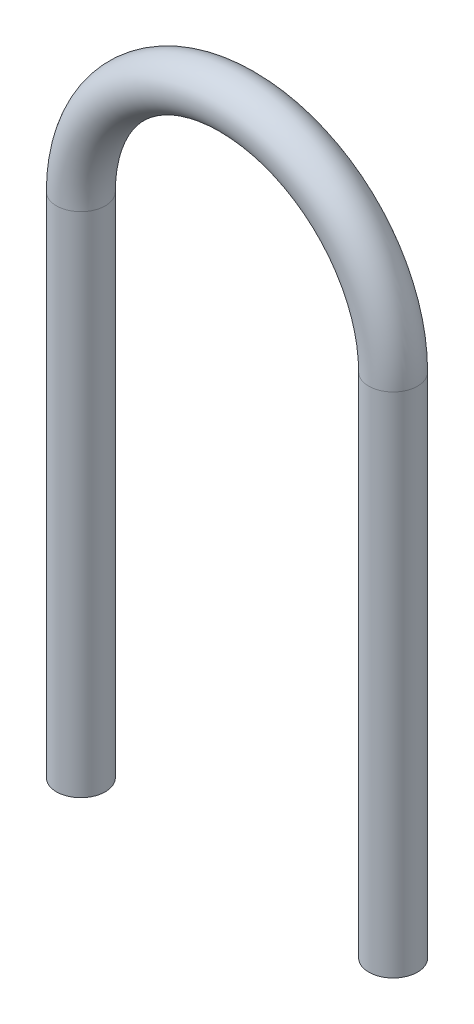
from build123d import *

# Parameters (mm, degrees)
ESQUISSE4_R = 3.96875


with BuildPart() as part:
    # Balayage1: sweep along a path in Esquisse1
    with BuildLine(Plane.XY) as balayage1_path:
        Line((-25.4, -82.55), (-25.4, 0))
        ThreePointArc((-25.4, 0), (0, 25.4), (25.4, 0))
        Line((25.4, 0), (25.4, -82.55))
    # Esquisse4 → Balayage1 (sweep)
    with BuildSketch(Plane(origin=(0, -82.55, 0), x_dir=(-1, 0, 0), z_dir=(0, 1, 0))):
        with Locations((-25.4, 0)):
            Circle(ESQUISSE4_R)
    sweep(path=balayage1_path.line)


solid = part.part
